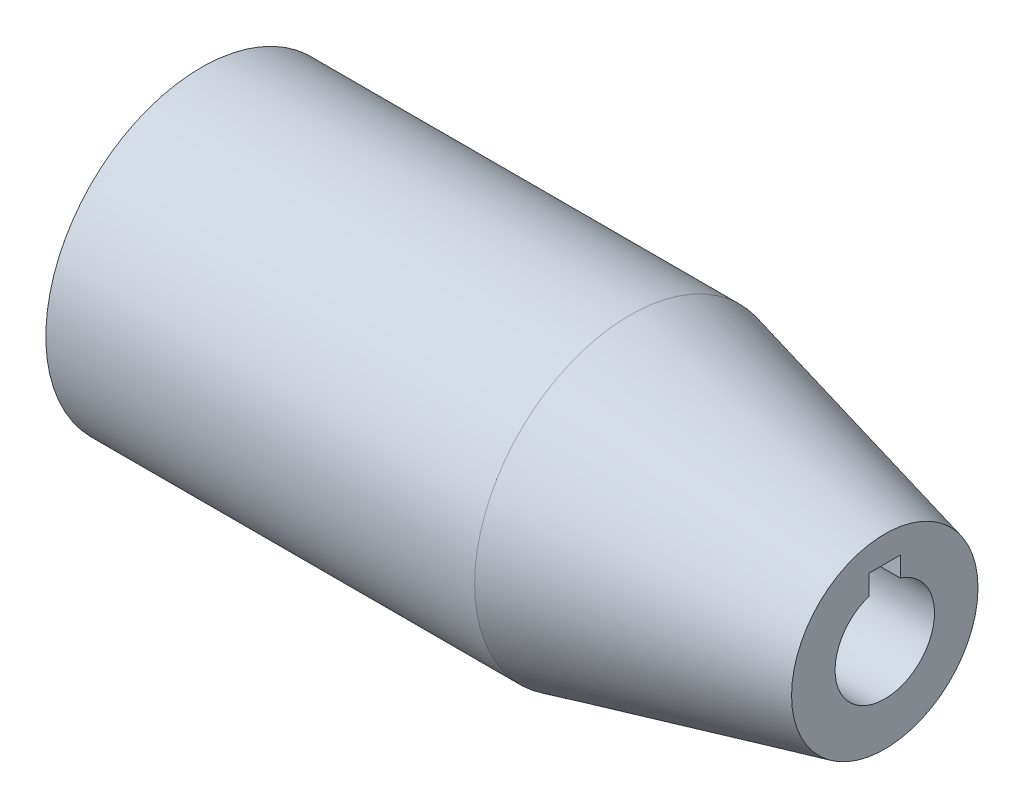
from build123d import *

# Parameters (mm, degrees)
SKETCH_2_R      = 15
EXTRUDE_2_DEPTH = 41
SKETCH_5_R      = 25
EXTRUDE_4_DEPTH = 9
EXTRUDE_START   = -9
SKETCH_6_R      = 25
EXTRUDE_5_DEPTH = 60


with BuildPart() as part:
    # Эскиз2 → Бобышка-Вытянуть2 (new body)
    with BuildSketch(Plane(origin=(0, 0, 0), x_dir=(0, 0, -1), z_dir=(1, 0, 0))):
        Circle(SKETCH_2_R)
        with BuildLine():
            Line((2.5, 10.8), (2.5, 7.599342077))
            ThreePointArc((2.5, 7.599342077), (6.480740698, 4.69041576), (8, 0))
            ThreePointArc((8, 0), (-4.69041576, -6.480740698), (-2.5, 7.599342077))
            Line((-2.5, 7.599342077), (-2.5, 10.8))
            Line((-2.5, 10.8), (0, 10.8))
            Line((0, 10.8), (2.5, 10.8))
        make_face(mode=Mode.SUBTRACT)
    extrude(amount=EXTRUDE_2_DEPTH)

    # Эскиз5 → Бобышка-Вытянуть4 (add)
    with BuildSketch(Plane(origin=(0, 0, 0), x_dir=(0, 0, -1), z_dir=(1, 0, 0))):
        Circle(SKETCH_5_R)
    extrude(amount=-EXTRUDE_4_DEPTH)

    # Эскиз6 → Бобышка-Вытянуть5 (add)
    with BuildSketch(Plane(origin=(0, 0, 0), x_dir=(0, 0, -1), z_dir=(1, 0, 0)).offset(EXTRUDE_START)):
        Circle(SKETCH_6_R)
        with BuildLine():
            ThreePointArc((14, 0), (-8.366600265, -11.22497216), (-4, 13.416407865))
            Line((-4, 13.416407865), (-4, 17.3))
            Line((-4, 17.3), (0, 17.3))
            Line((0, 17.3), (4, 17.3))
            Line((4, 17.3), (4, 13.416407865))
            ThreePointArc((4, 13.416407865), (11.22497216, 8.366600265), (14, 0))
        make_face(mode=Mode.SUBTRACT)
    extrude(amount=-EXTRUDE_5_DEPTH)

    # Эскиз7 → Повернуть1 (revolve)
    with BuildSketch(Plane(origin=(0, 0, 0), x_dir=(1, 0, 0), z_dir=(0, 1, 0)), mode=Mode.PRIVATE) as revolve_1_sk:
        Polygon((0, 25), (0, 15), (41, 15), align=None)
    revolve(revolve_1_sk.sketch.rotate(Axis((-60.197075593, 0, 0), (1, 0, 0)), 180), axis=Axis((-60.197075593, 0, 0), (1, 0, 0)))


solid = part.part
